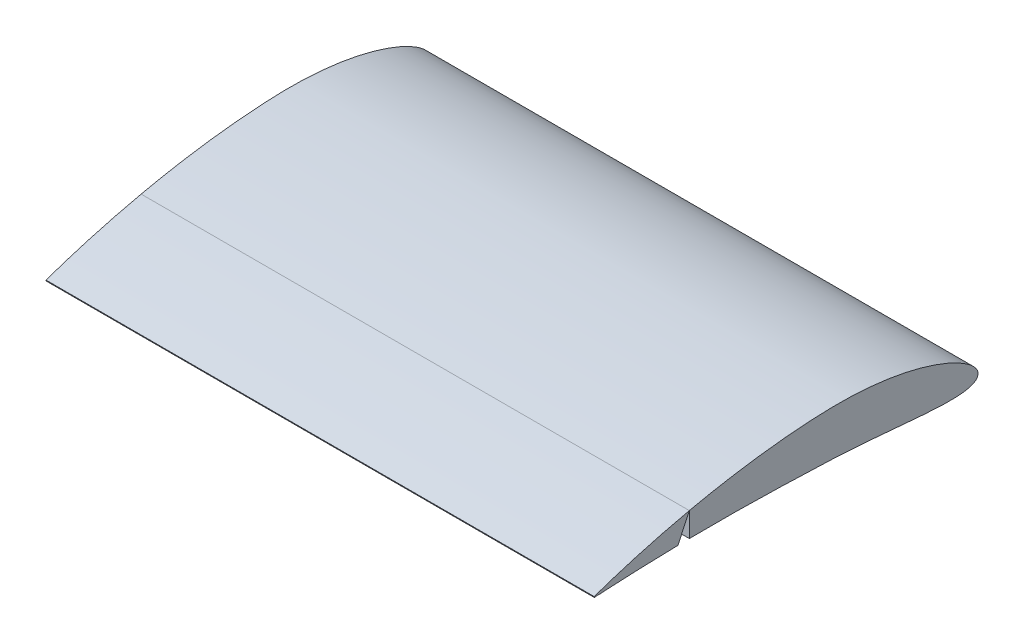
from build123d import *

# Parameters (mm, degrees)
BOSS_EXTRUDE1_DEPTH      = 254
BOSS_EXTRUDE1_DEPTH_BACK = 254
CUT_EXTRUDE1_REACH       = 623.109
SKETCH3_R                = 6.35
CUT_EXTRUDE2_DEPTH       = 101.6
SKETCH4_R                = 3.175
CUT_EXTRUDE3_DEPTH       = 127


with BuildPart() as part:
    # Sketch1 → Boss-Extrude1 (new, two sides: drawn at the far end of the back side and taken through both)
    with BuildSketch(Plane(origin=(0, 0, 0), x_dir=(0, 0, -1), z_dir=(1, 0, 0)).offset(-BOSS_EXTRUDE1_DEPTH_BACK)):
        with BuildLine():
            Line((-354.787327228, -0.030257196), (-354.876173011, 0.410417887))
            add(Edge.make_bspline(
                [(-354.876173011, 0.410417887), (-354.559877309, 0.519388), (-353.29965963, 0.95355787), (-350.47872665, 1.927095868), (-345.800950265, 3.497798274), (-336.024074692, 6.721551148), (-319.654473712, 11.798891927), (-300.598349456, 17.130600639), (-282.422876264, 21.724272526), (-261.175777938, 26.651569731), (-238.622276389, 31.145528798), (-208.774809213, 36.004755717), (-183.96165787, 39.090454058), (-158.902335219, 41.113212891), (-140.096691022, 42.111376668), (-121.516747473, 42.228858195), (-103.422167262, 41.321050632), (-86.188408528, 39.478676181), (-70.043450957, 36.810480574), (-55.199760436, 33.432905997), (-41.843390777, 29.510854383), (-30.130463623, 25.220125297), (-20.187014188, 20.73431935), (-12.107203154, 16.226289935), (-5.926897661, 11.855341958), (-1.679224073, 7.716499794), (0.765838065, 3.796757813), (0.987487677, -0.148325216), (-1.35108726, -3.308943186), (-5.450780885, -5.288085739), (-11.087315968, -6.587464624), (-18.34911979, -7.268527656), (-27.163826626, -7.404874951), (-37.447057223, -7.053797092), (-49.083078017, -6.301866785), (-61.95239395, -5.238034817), (-75.929862643, -3.983911698), (-96.406736552, -2.153555858), (-117.937239158, -0.458414508), (-140.484776897, 0.674535203), (-158.296467959, 1.286744043), (-176.48388462, 1.917893193), (-200.671973719, 2.586246563), (-224.541124114, 2.979106232), (-247.830237405, 3.028480659), (-264.337268621, 2.907447598), (-279.933149694, 2.656365926), (-294.437996632, 2.282890374), (-307.681856469, 1.852126627), (-319.513378006, 1.371074809), (-329.767358246, 0.912902227), (-338.388880463, 0.426846955), (-345.076973543, 0.191518705), (-350.227621538, -0.406394891), (-352.780150329, -0.035387827), (-354.744619464, -0.75811662), (-354.777220059, -0.20251155), (-354.787327228, -0.030257196)],
                knots=[0, 0, 0, 0, 0.001371577, 0.005464776, 0.012234802, 0.021601969, 0.04767125, 0.082496261, 0.102719149, 0.124527079, 0.171912573, 0.19697838, 0.248496767, 0.274385101, 0.300041178, 0.325689988, 0.350525088, 0.374279703, 0.396711254, 0.417576734, 0.436654006, 0.45374439, 0.468679994, 0.481329415, 0.491630702, 0.499615789, 0.505546281, 0.510184984, 0.514824194, 0.520701508, 0.52851604, 0.538465752, 0.550542609, 0.564643256, 0.580638139, 0.598344876, 0.617584458, 0.638174401, 0.682632113, 0.706120665, 0.730727383, 0.755700244, 0.780731769, 0.829932396, 0.853570292, 0.876213105, 0.897609987, 0.917519394, 0.935698347, 0.951942678, 0.966047159, 0.97783994, 0.987174002, 0.993931501, 0.998018399, 0.999385644, 1, 1, 1, 1], degree=3))
        make_face()
    extrude(amount=BOSS_EXTRUDE1_DEPTH + BOSS_EXTRUDE1_DEPTH_BACK)

    # Sketch2 → Cut-Extrude1 (cut, up to next)
    with BuildSketch(Plane.ZY.offset(254), mode=Mode.PRIVATE) as cut_extrude1_sk1:
        Polygon((266.7, 25.310988042), (266.7, 2.06571301), (277.539449763, 2.06571301), align=None)
    cut_extrude1_tool1 = extrude(cut_extrude1_sk1.sketch, amount=-CUT_EXTRUDE1_REACH, mode=Mode.PRIVATE) & part.part
    add(cut_extrude1_tool1.solids().sort_by_distance((-254, 9.814138, 270.31315))[0], mode=Mode.SUBTRACT)


with BuildPart() as cut_extrude1_piece_1:
    # of the separate pieces the step leaves, piece 1, a body of its own (cut_extrude1_pieces)
    add(part.part.solids().sort_by_distance((0, 2.854788865, 266.7))[0])

    # Sketch3 → Cut-Extrude2 (cut)
    with BuildSketch(Plane.ZY.offset(254)):
        with Locations((63.5, 12.7)):
            Circle(SKETCH3_R)
    extrude(amount=-CUT_EXTRUDE2_DEPTH, mode=Mode.SUBTRACT)

    # Sketch4 → Cut-Extrude3 (cut)
    with BuildSketch(Plane.ZY.offset(254)):
        with Locations((241.3, 12.7)):
            Circle(SKETCH4_R)
    extrude(amount=-CUT_EXTRUDE3_DEPTH, mode=Mode.SUBTRACT)


with BuildPart() as cut_extrude1_piece_2:
    # of the separate pieces the step leaves, piece 2, a body of its own (cut_extrude1_pieces)
    add(part.part.solids().sort_by_distance((0, -0.030257196, 354.787327228))[0])


solid = Compound([cut_extrude1_piece_1.part, cut_extrude1_piece_2.part])
